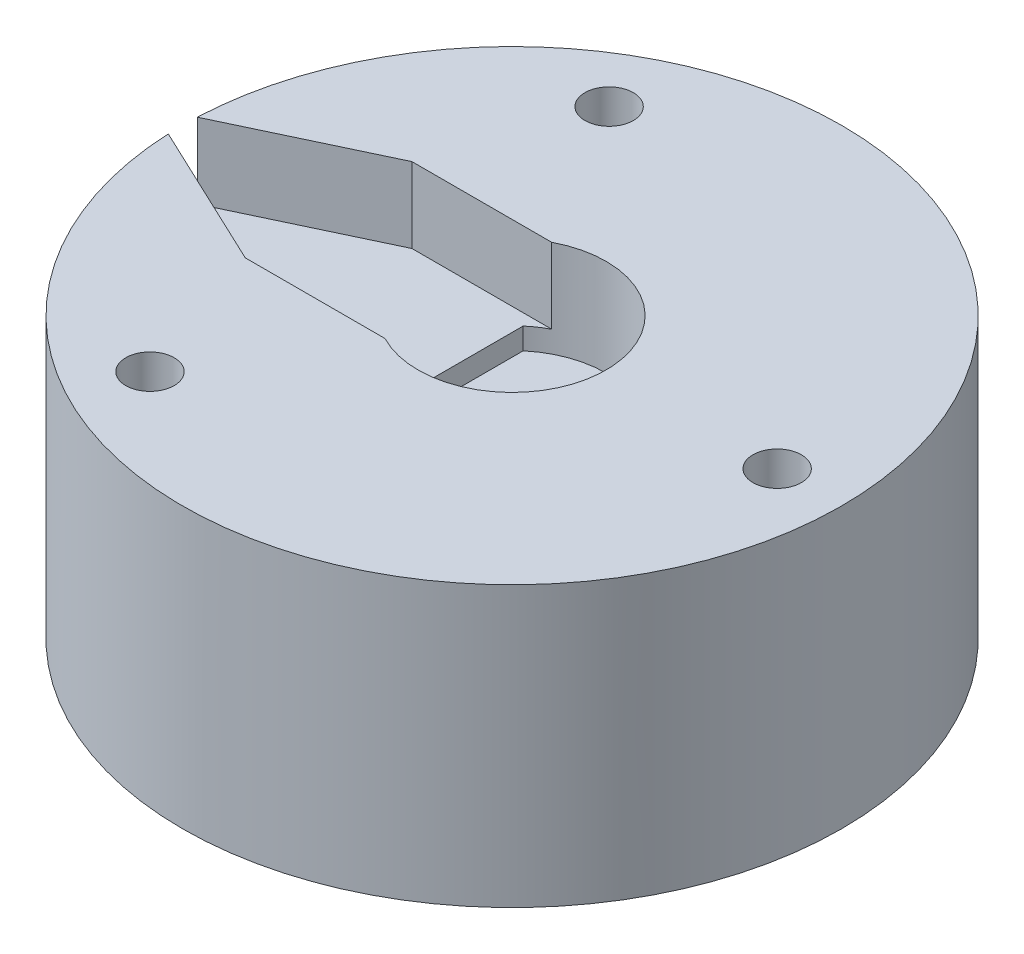
from build123d import *

# Parameters (mm, degrees)
CUT_EXTRUDE_1316_DEPTH = 9
CUT_EXTRUDE_1657_DEPTH = 2
CUT_EXTRUDE_1713_DEPTH = 7
SKETCH_1963_R          = 2.25
CUT_EXTRUDE_2333_DEPTH = 51.545474575


with BuildPart() as part:
    # Эскиз1 → Повернуть1 (revolve)
    with BuildSketch(Plane.XY):
        Polygon((0, 26), (30.65, 26), (30.65, 0), (18.65, 0), (18.65, 7), (17.15, 7), (17.15, 13.5), (3.65, 13.5), (3.65, 17), (0, 17), align=None)
    revolve(axis=Axis((0, 0, 0), (0, 1, 0)))

    # Sketch 667 → Cut-Extrude 1316 (cut)
    with BuildSketch(Plane(origin=(0, 26, 0), x_dir=(1, 0, 0), z_dir=(0, 1, 0))):
        with BuildLine():
            Line((5.65, -6.681317235), (5.65, 6.681317235))
            ThreePointArc((5.65, 6.681317235), (0, 8.75), (-5.65, 6.681317235))
            Line((-5.65, 6.681317235), (-5.65, -6.681317235))
            ThreePointArc((-5.65, -6.681317235), (0, -8.75), (5.65, -6.681317235))
        make_face()
    extrude(amount=-CUT_EXTRUDE_1316_DEPTH, mode=Mode.SUBTRACT)

    # Sketch 1370 → Cut-Extrude 1657 (cut)
    with BuildSketch(Plane(origin=(0, 17, 0), x_dir=(1, 0, 0), z_dir=(0, 1, 0))):
        with BuildLine():
            Line((-0.92, -7.2), (0.92, -7.2))
            ThreePointArc((0.92, -7.2), (1.330121933, -7.369878067), (1.5, -7.78))
            Line((1.5, -7.78), (1.5, -8.082233602))
            ThreePointArc((1.5, -8.082233602), (1.341523495, -8.496233679), (0.947109471, -8.6985909))
            ThreePointArc((0.947109471, -8.6985909), (0, -8.75), (-0.947109471, -8.6985909))
            ThreePointArc((-0.947109471, -8.6985909), (-1.341523495, -8.496233679), (-1.5, -8.082233602))
            Line((-1.5, -8.082233602), (-1.5, -7.78))
            ThreePointArc((-1.5, -7.78), (-1.330121933, -7.369878067), (-0.92, -7.2))
        make_face()
    extrude(amount=-CUT_EXTRUDE_1657_DEPTH, mode=Mode.SUBTRACT)

    # Эскиз под резистор<3> → Cut-Extrude 1713 (cut)
    with BuildSketch(Plane(origin=(0, 26, 0), x_dir=(1, 0, 0), z_dir=(0, 1, 0))):
        with BuildLine():
            ThreePointArc((5.65, -6.681317235), (8.75, 0), (5.65, 6.681317235))
            Line((5.65, 6.681317235), (5.65, -6.681317235))
        make_face()
        with BuildLine():
            ThreePointArc((-5.65, 6.681317235), (-4.885319842, 7.259211392), (-4.062019202, 7.75))
            Line((-4.062019202, 7.75), (-17.062019202, 7.75))
            Line((-17.062019202, 7.75), (-30.620254734, 1.35))
            ThreePointArc((-30.620254734, 1.35), (-30.65, 0), (-30.620254734, -1.35))
            Line((-30.620254734, -1.35), (-17.062019202, -7.75))
            Line((-17.062019202, -7.75), (-4.062019202, -7.75))
            ThreePointArc((-4.062019202, -7.75), (-4.885319842, -7.259211392), (-5.65, -6.681317235))
            Line((-5.65, -6.681317235), (-5.65, 6.681317235))
        make_face()
    extrude(amount=-CUT_EXTRUDE_1713_DEPTH, mode=Mode.SUBTRACT)

    # Sketch 1963 → Cut-Extrude 2333 (cut, through all)
    with BuildSketch(Plane(origin=(0, 26, 0), x_dir=(1, 0, 0), z_dir=(0, 1, 0))):
        with Locations((24.65, 0)):
            Circle(SKETCH_1963_R)
        with Locations((-12.325, -21.347526203)):
            Circle(SKETCH_1963_R)
        with Locations((-12.325, 21.347526203)):
            Circle(SKETCH_1963_R)
    extrude(amount=-CUT_EXTRUDE_2333_DEPTH, mode=Mode.SUBTRACT)


solid = part.part
